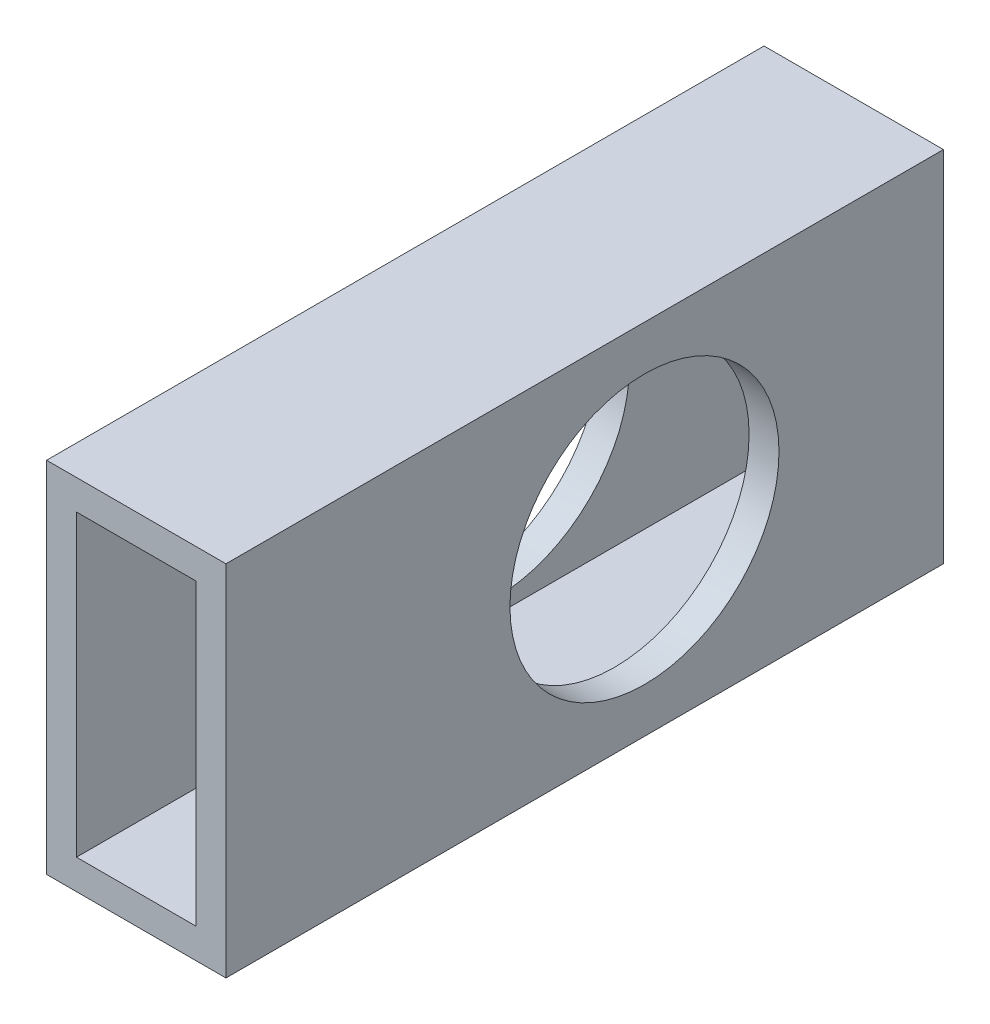
from build123d import *

# Parameters (mm, degrees)
SKETCH1_W           = 19.05
SKETCH1_H           = 38.1
SKETCH1_W_2         = 12.7
SKETCH1_H_2         = 31.75
EXTRUDE_THIN1_DEPTH = 76.2
SKETCH2_R           = 14.2875
CUT_EXTRUDE1_DEPTH  = 88.298066989


with BuildPart() as part:
    # Sketch1 → Extrude-Thin1 (new body)
    with BuildSketch(Plane.XY):
        with Locations((9.525, 19.05)):
            Rectangle(SKETCH1_W, SKETCH1_H)
        with Locations((9.525, 19.05)):
            Rectangle(SKETCH1_W_2, SKETCH1_H_2, mode=Mode.SUBTRACT)
    extrude(amount=EXTRUDE_THIN1_DEPTH)

    # Sketch2 → Cut-Extrude1 (cut, through all)
    with BuildSketch(Plane(origin=(19.05, 0, 0), x_dir=(0, 0, -1), z_dir=(1, 0, 0))):
        with Locations((-31.75, 19.05)):
            Circle(SKETCH2_R)
    extrude(amount=-CUT_EXTRUDE1_DEPTH, mode=Mode.SUBTRACT)


solid = part.part
